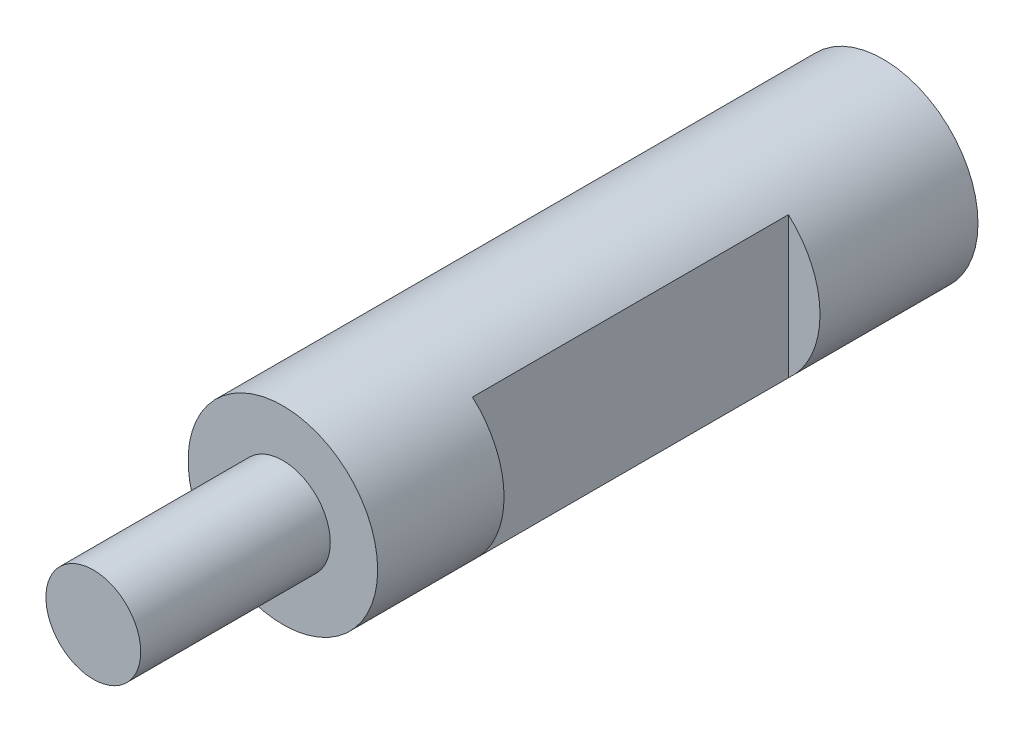
from build123d import *

# Parameters (mm, degrees)
SKETCH_1_R                   = 3
EXTRUDE_1_DEPTH              = 19
SKETCH_2_W                   = 1
SKETCH_2_H                   = 10
CUT_EXTRUDE_2_DEPTH          = 9.25
HOLE_WIZARD_M3_1_D           = 2.5
HOLE_WIZARD_M3_1_DEPTH       = 7.5
HOLE_WIZARD_M3_1_CBORE_D     = 3
HOLE_WIZARD_M3_1_CBORE_DEPTH = 6
HOLE_WIZARD_M3_1_TIP         = 0.751075774
SKETCH_4_R                   = 1.5
EXTRUDE_3_DEPTH              = 6


with BuildPart() as part:
    # 草图1 → 拉伸1 (new body)
    with BuildSketch(Plane.XY):
        Circle(SKETCH_1_R)
    extrude(amount=EXTRUDE_1_DEPTH)

    # 草图2 → 拉伸2 (cut, symmetric)
    with BuildSketch(Plane(origin=(0, 0, 0), x_dir=(1, 0, 0), z_dir=(0, 1, 0))):
        with Locations((-2.5, -10)):
            Rectangle(SKETCH_2_W, SKETCH_2_H)
        with Locations((2.5, -10)):
            Rectangle(SKETCH_2_W, SKETCH_2_H)
    extrude(amount=CUT_EXTRUDE_2_DEPTH, both=True, mode=Mode.SUBTRACT)

    # M3 螺纹孔1
    with Locations(Plane(origin=(0, 0, 0), x_dir=(-1, 0, 0), z_dir=(0, 0, -1))):
        with Locations((0, 0)):
            CounterBoreHole(HOLE_WIZARD_M3_1_D / 2, HOLE_WIZARD_M3_1_CBORE_D / 2, HOLE_WIZARD_M3_1_CBORE_DEPTH, depth=HOLE_WIZARD_M3_1_DEPTH)
            with Locations((0, 0, -(HOLE_WIZARD_M3_1_DEPTH + HOLE_WIZARD_M3_1_TIP / 2))):  # 118° drill point
                Cone(0, HOLE_WIZARD_M3_1_D / 2, HOLE_WIZARD_M3_1_TIP, mode=Mode.SUBTRACT)

    # 草图4 → 拉伸3 (add)
    with BuildSketch(Plane.XY.offset(19)):
        with Locations(Location((0, 0, 0), (0, 0, 180))):
            Circle(SKETCH_4_R)
    extrude(amount=EXTRUDE_3_DEPTH)


solid = part.part
